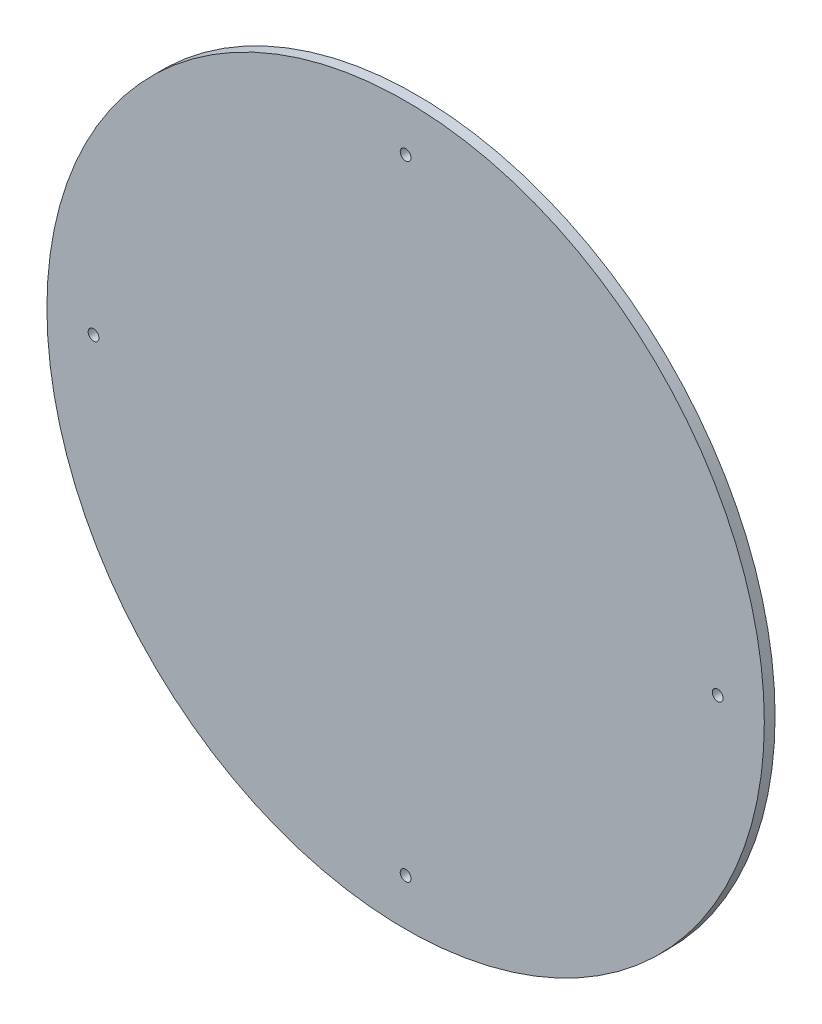
from build123d import *

# Parameters (mm, degrees)
CROQUIS1_R              = 100
SALIENTE_EXTRUIR1_DEPTH = 3
CROQUIS5_R              = 1.5
CORTAR_EXTRUIR4_DEPTH   = 3


with BuildPart() as part:
    # Croquis1 → Saliente-Extruir1 (new body)
    with BuildSketch(Plane.XY):
        Circle(CROQUIS1_R)
    extrude(amount=SALIENTE_EXTRUIR1_DEPTH)

    # Croquis5 → Cortar-Extruir4 (cut)
    with BuildSketch(Plane.XY.offset(3)):
        with Locations((0, 87)):
            Circle(CROQUIS5_R)
        with Locations((87, 0)):
            Circle(CROQUIS5_R)
        with Locations((0, -87)):
            Circle(CROQUIS5_R)
        with Locations((-87, 0)):
            Circle(CROQUIS5_R)
    extrude(amount=-CORTAR_EXTRUIR4_DEPTH, mode=Mode.SUBTRACT)


solid = part.part
